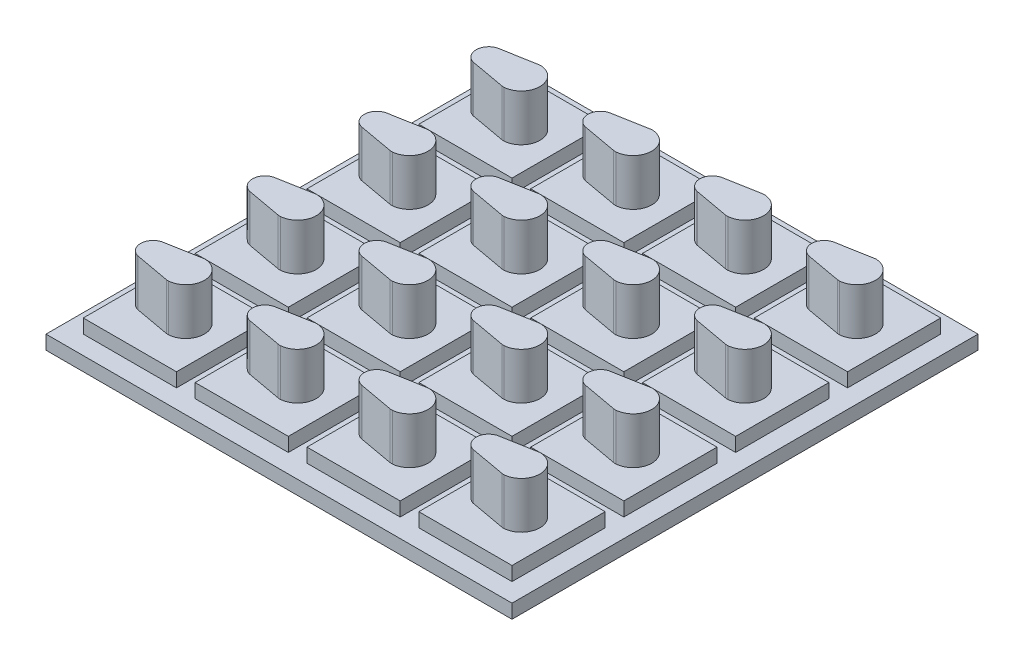
from build123d import *

# Parameters (mm, degrees)
SKETCH1_W              = 10
SKETCH1_H              = 10
BOSS_EXTRUDE5_DEPTH    = 1.5
BOSS_EXTRUDE5_2_DEPTH  = 1.5
BOSS_EXTRUDE5_3_DEPTH  = 1.5
BOSS_EXTRUDE5_4_DEPTH  = 1.5
BOSS_EXTRUDE5_5_DEPTH  = 1.5
BOSS_EXTRUDE5_6_DEPTH  = 1.5
BOSS_EXTRUDE5_7_DEPTH  = 1.5
BOSS_EXTRUDE5_8_DEPTH  = 1.5
BOSS_EXTRUDE5_9_DEPTH  = 1.5
BOSS_EXTRUDE5_10_DEPTH = 1.5
BOSS_EXTRUDE5_11_DEPTH = 1.5
BOSS_EXTRUDE5_12_DEPTH = 1.5
BOSS_EXTRUDE5_13_DEPTH = 1.5
BOSS_EXTRUDE5_14_DEPTH = 1.5
BOSS_EXTRUDE5_15_DEPTH = 1.5
BOSS_EXTRUDE5_16_DEPTH = 1.5
BOSS_EXTRUDE6_DEPTH    = 6.5
SKETCH1_15_W           = 50
SKETCH1_15_H           = 50
BOSS_EXTRUDE7_DEPTH    = 1.5


with BuildPart() as part:
    # Sketch1 → Boss-Extrude5 (new body)
    with BuildSketch(Plane(origin=(0, 0, 0), x_dir=(1, 0, 0), z_dir=(0, 1, 0))):
        with Locations((-37, 24)):
            Rectangle(SKETCH1_W, SKETCH1_H)
    extrude(amount=BOSS_EXTRUDE5_DEPTH)



with BuildPart() as body_2:
    # Sketch1 → Boss-Extrude5 2 (new body)
    with BuildSketch(Plane(origin=(0, 0, 0), x_dir=(1, 0, 0), z_dir=(0, 1, 0))):
        with Locations((-25, 24)):
            Rectangle(SKETCH1_W, SKETCH1_H)
    extrude(amount=BOSS_EXTRUDE5_2_DEPTH)


with BuildPart() as body_3:
    # Sketch1 → Boss-Extrude5 3 (new body)
    with BuildSketch(Plane(origin=(0, 0, 0), x_dir=(1, 0, 0), z_dir=(0, 1, 0))):
        with Locations((-13, 24)):
            Rectangle(SKETCH1_W, SKETCH1_H)
    extrude(amount=BOSS_EXTRUDE5_3_DEPTH)


with BuildPart() as body_4:
    # Sketch1 → Boss-Extrude5 4 (new body)
    with BuildSketch(Plane(origin=(0, 0, 0), x_dir=(1, 0, 0), z_dir=(0, 1, 0))):
        with Locations((-1, 24)):
            Rectangle(SKETCH1_W, SKETCH1_H)
    extrude(amount=BOSS_EXTRUDE5_4_DEPTH)


with BuildPart() as body_5:
    # Sketch1 → Boss-Extrude5 5 (new body)
    with BuildSketch(Plane(origin=(0, 0, 0), x_dir=(1, 0, 0), z_dir=(0, 1, 0))):
        with Locations((-37, 12)):
            Rectangle(SKETCH1_W, SKETCH1_H)
    extrude(amount=BOSS_EXTRUDE5_5_DEPTH)


with BuildPart() as body_6:
    # Sketch1 → Boss-Extrude5 6 (new body)
    with BuildSketch(Plane(origin=(0, 0, 0), x_dir=(1, 0, 0), z_dir=(0, 1, 0))):
        with Locations((-25, 12)):
            Rectangle(SKETCH1_W, SKETCH1_H)
    extrude(amount=BOSS_EXTRUDE5_6_DEPTH)


with BuildPart() as body_7:
    # Sketch1 → Boss-Extrude5 7 (new body)
    with BuildSketch(Plane(origin=(0, 0, 0), x_dir=(1, 0, 0), z_dir=(0, 1, 0))):
        with Locations((-13, 12)):
            Rectangle(SKETCH1_W, SKETCH1_H)
    extrude(amount=BOSS_EXTRUDE5_7_DEPTH)


with BuildPart() as body_8:
    # Sketch1 → Boss-Extrude5 8 (new body)
    with BuildSketch(Plane(origin=(0, 0, 0), x_dir=(1, 0, 0), z_dir=(0, 1, 0))):
        with Locations((-1, 12)):
            Rectangle(SKETCH1_W, SKETCH1_H)
    extrude(amount=BOSS_EXTRUDE5_8_DEPTH)


with BuildPart() as body_9:
    # Sketch1 → Boss-Extrude5 9 (new body)
    with BuildSketch(Plane(origin=(0, 0, 0), x_dir=(1, 0, 0), z_dir=(0, 1, 0))):
        with Locations((-1, 0)):
            Rectangle(SKETCH1_W, SKETCH1_H)
    extrude(amount=BOSS_EXTRUDE5_9_DEPTH)


with BuildPart() as body_10:
    # Sketch1 → Boss-Extrude5 10 (new body)
    with BuildSketch(Plane(origin=(0, 0, 0), x_dir=(1, 0, 0), z_dir=(0, 1, 0))):
        with Locations((-13, 0)):
            Rectangle(SKETCH1_W, SKETCH1_H)
    extrude(amount=BOSS_EXTRUDE5_10_DEPTH)


with BuildPart() as body_11:
    # Sketch1 → Boss-Extrude5 11 (new body)
    with BuildSketch(Plane(origin=(0, 0, 0), x_dir=(1, 0, 0), z_dir=(0, 1, 0))):
        with Locations((-25, 0)):
            Rectangle(SKETCH1_W, SKETCH1_H)
    extrude(amount=BOSS_EXTRUDE5_11_DEPTH)


with BuildPart() as body_12:
    # Sketch1 → Boss-Extrude5 12 (new body)
    with BuildSketch(Plane(origin=(0, 0, 0), x_dir=(1, 0, 0), z_dir=(0, 1, 0))):
        with Locations((-37, 0)):
            Rectangle(SKETCH1_W, SKETCH1_H)
    extrude(amount=BOSS_EXTRUDE5_12_DEPTH)


with BuildPart() as body_13:
    # Sketch1 → Boss-Extrude5 13 (new body)
    with BuildSketch(Plane(origin=(0, 0, 0), x_dir=(1, 0, 0), z_dir=(0, 1, 0))):
        with Locations((-37, -12)):
            Rectangle(SKETCH1_W, SKETCH1_H)
    extrude(amount=BOSS_EXTRUDE5_13_DEPTH)


with BuildPart() as body_14:
    # Sketch1 → Boss-Extrude5 14 (new body)
    with BuildSketch(Plane(origin=(0, 0, 0), x_dir=(1, 0, 0), z_dir=(0, 1, 0))):
        with Locations((-25, -12)):
            Rectangle(SKETCH1_W, SKETCH1_H)
    extrude(amount=BOSS_EXTRUDE5_14_DEPTH)


with BuildPart() as body_15:
    # Sketch1 → Boss-Extrude5 15 (new body)
    with BuildSketch(Plane(origin=(0, 0, 0), x_dir=(1, 0, 0), z_dir=(0, 1, 0))):
        with Locations((-13, -12)):
            Rectangle(SKETCH1_W, SKETCH1_H)
    extrude(amount=BOSS_EXTRUDE5_15_DEPTH)


with BuildPart() as body_16:
    # Sketch1 → Boss-Extrude5 16 (new body)
    with BuildSketch(Plane(origin=(0, 0, 0), x_dir=(1, 0, 0), z_dir=(0, 1, 0))):
        with Locations((-1, -12)):
            Rectangle(SKETCH1_W, SKETCH1_H)
    extrude(amount=BOSS_EXTRUDE5_16_DEPTH)


with BuildPart() as part_1:
    add(part.part)

    add(body_2.part)  # Boss-Extrude6 merges body 2

    add(body_3.part)  # Boss-Extrude6 merges body 3

    add(body_4.part)  # Boss-Extrude6 merges body 4

    add(body_5.part)  # Boss-Extrude6 merges body 5

    add(body_6.part)  # Boss-Extrude6 merges body 6

    add(body_7.part)  # Boss-Extrude6 merges body 7

    add(body_8.part)  # Boss-Extrude6 merges body 8

    add(body_9.part)  # Boss-Extrude6 merges body 9

    add(body_10.part)  # Boss-Extrude6 merges body 10

    add(body_11.part)  # Boss-Extrude6 merges body 11

    add(body_12.part)  # Boss-Extrude6 merges body 12

    add(body_13.part)  # Boss-Extrude6 merges body 13

    add(body_14.part)  # Boss-Extrude6 merges body 14

    add(body_15.part)  # Boss-Extrude6 merges body 15

    add(body_16.part)  # Boss-Extrude6 merges body 16
    # Sketch1<13> → Boss-Extrude6 (add)
    with BuildSketch(Plane(origin=(0, 0, 0), x_dir=(1, 0, 0), z_dir=(0, 1, 0))):
        with BuildLine():
            ThreePointArc((0.14860526, 1.994471478), (0.022146835, 1.995874699), (-0.103477426, 1.981305986))
            Line((-0.103477426, 1.981305986), (-3.791774707, 1.314985976))
            ThreePointArc((-3.791774707, 1.314985976), (-3.866472803, 1.298518324), (-3.939693652, 1.27638924))
            ThreePointArc((-3.939693652, 1.27638924), (-4.85, 0), (-3.939693652, -1.27638924))
            ThreePointArc((-3.939693652, -1.27638924), (-3.866472803, -1.298518324), (-3.791774707, -1.314985976))
            Line((-3.791774707, -1.314985976), (-0.103477426, -1.981305986))
            ThreePointArc((-0.103477426, -1.981305986), (0.022146835, -1.995874699), (0.14860526, -1.994471478))
            ThreePointArc((0.14860526, -1.994471478), (2, 0), (0.14860526, 1.994471478))
        make_face()
        with BuildLine():
            ThreePointArc((-11.85139474, 1.994471478), (-11.977853165, 1.995874699), (-12.103477426, 1.981305986))
            Line((-12.103477426, 1.981305986), (-15.791774707, 1.314985976))
            ThreePointArc((-15.791774707, 1.314985976), (-15.866472803, 1.298518324), (-15.939693652, 1.27638924))
            ThreePointArc((-15.939693652, 1.27638924), (-16.85, 0), (-15.939693652, -1.27638924))
            ThreePointArc((-15.939693652, -1.27638924), (-15.866472803, -1.298518324), (-15.791774707, -1.314985976))
            Line((-15.791774707, -1.314985976), (-12.103477426, -1.981305986))
            ThreePointArc((-12.103477426, -1.981305986), (-11.977853165, -1.995874699), (-11.85139474, -1.994471478))
            ThreePointArc((-11.85139474, -1.994471478), (-10, 0), (-11.85139474, 1.994471478))
        make_face()
        with BuildLine():
            ThreePointArc((-23.85139474, 1.994471478), (-23.977853165, 1.995874699), (-24.103477426, 1.981305986))
            Line((-24.103477426, 1.981305986), (-27.791774707, 1.314985976))
            ThreePointArc((-27.791774707, 1.314985976), (-27.866472803, 1.298518324), (-27.939693652, 1.27638924))
            ThreePointArc((-27.939693652, 1.27638924), (-28.85, 0), (-27.939693652, -1.27638924))
            ThreePointArc((-27.939693652, -1.27638924), (-27.866472803, -1.298518324), (-27.791774707, -1.314985976))
            Line((-27.791774707, -1.314985976), (-24.103477426, -1.981305986))
            ThreePointArc((-24.103477426, -1.981305986), (-23.977853165, -1.995874699), (-23.85139474, -1.994471478))
            ThreePointArc((-23.85139474, -1.994471478), (-22, 0), (-23.85139474, 1.994471478))
        make_face()
        with BuildLine():
            ThreePointArc((0.14860526, 13.994471478), (0.022146835, 13.995874699), (-0.103477426, 13.981305986))
            Line((-0.103477426, 13.981305986), (-3.791774707, 13.314985976))
            ThreePointArc((-3.791774707, 13.314985976), (-3.866472803, 13.298518324), (-3.939693652, 13.27638924))
            ThreePointArc((-3.939693652, 13.27638924), (-4.85, 12), (-3.939693652, 10.72361076))
            ThreePointArc((-3.939693652, 10.72361076), (-3.866472803, 10.701481676), (-3.791774707, 10.685014024))
            Line((-3.791774707, 10.685014024), (-0.103477426, 10.018694014))
            ThreePointArc((-0.103477426, 10.018694014), (0.022146835, 10.004125301), (0.14860526, 10.005528522))
            ThreePointArc((0.14860526, 10.005528522), (2, 12), (0.14860526, 13.994471478))
        make_face()
        with BuildLine():
            ThreePointArc((-11.85139474, 13.994471478), (-11.977853165, 13.995874699), (-12.103477426, 13.981305986))
            Line((-12.103477426, 13.981305986), (-15.791774707, 13.314985976))
            ThreePointArc((-15.791774707, 13.314985976), (-15.866472803, 13.298518324), (-15.939693652, 13.27638924))
            ThreePointArc((-15.939693652, 13.27638924), (-16.85, 12), (-15.939693652, 10.72361076))
            ThreePointArc((-15.939693652, 10.72361076), (-15.866472803, 10.701481676), (-15.791774707, 10.685014024))
            Line((-15.791774707, 10.685014024), (-12.103477426, 10.018694014))
            ThreePointArc((-12.103477426, 10.018694014), (-11.977853165, 10.004125301), (-11.85139474, 10.005528522))
            ThreePointArc((-11.85139474, 10.005528522), (-10, 12), (-11.85139474, 13.994471478))
        make_face()
        with BuildLine():
            ThreePointArc((-23.85139474, 13.994471478), (-23.977853165, 13.995874699), (-24.103477426, 13.981305986))
            Line((-24.103477426, 13.981305986), (-27.791774707, 13.314985976))
            ThreePointArc((-27.791774707, 13.314985976), (-27.866472803, 13.298518324), (-27.939693652, 13.27638924))
            ThreePointArc((-27.939693652, 13.27638924), (-28.85, 12), (-27.939693652, 10.72361076))
            ThreePointArc((-27.939693652, 10.72361076), (-27.866472803, 10.701481676), (-27.791774707, 10.685014024))
            Line((-27.791774707, 10.685014024), (-24.103477426, 10.018694014))
            ThreePointArc((-24.103477426, 10.018694014), (-23.977853165, 10.004125301), (-23.85139474, 10.005528522))
            ThreePointArc((-23.85139474, 10.005528522), (-22, 12), (-23.85139474, 13.994471478))
        make_face()
        with BuildLine():
            ThreePointArc((-11.85139474, -10.005528522), (-11.977853165, -10.004125301), (-12.103477426, -10.018694014))
            Line((-12.103477426, -10.018694014), (-15.791774707, -10.685014024))
            ThreePointArc((-15.791774707, -10.685014024), (-15.866472803, -10.701481676), (-15.939693652, -10.72361076))
            ThreePointArc((-15.939693652, -10.72361076), (-16.85, -12), (-15.939693652, -13.27638924))
            ThreePointArc((-15.939693652, -13.27638924), (-15.866472803, -13.298518324), (-15.791774707, -13.314985976))
            Line((-15.791774707, -13.314985976), (-12.103477426, -13.981305986))
            ThreePointArc((-12.103477426, -13.981305986), (-11.977853165, -13.995874699), (-11.85139474, -13.994471478))
            ThreePointArc((-11.85139474, -13.994471478), (-10, -12), (-11.85139474, -10.005528522))
        make_face()
        with BuildLine():
            ThreePointArc((0.14860526, -10.005528522), (0.022146835, -10.004125301), (-0.103477426, -10.018694014))
            Line((-0.103477426, -10.018694014), (-3.791774707, -10.685014024))
            ThreePointArc((-3.791774707, -10.685014024), (-3.866472803, -10.701481676), (-3.939693652, -10.72361076))
            ThreePointArc((-3.939693652, -10.72361076), (-4.85, -12), (-3.939693652, -13.27638924))
            ThreePointArc((-3.939693652, -13.27638924), (-3.866472803, -13.298518324), (-3.791774707, -13.314985976))
            Line((-3.791774707, -13.314985976), (-0.103477426, -13.981305986))
            ThreePointArc((-0.103477426, -13.981305986), (0.022146835, -13.995874699), (0.14860526, -13.994471478))
            ThreePointArc((0.14860526, -13.994471478), (2, -12), (0.14860526, -10.005528522))
        make_face()
        with BuildLine():
            ThreePointArc((-23.85139474, -10.005528522), (-23.977853165, -10.004125301), (-24.103477426, -10.018694014))
            Line((-24.103477426, -10.018694014), (-27.791774707, -10.685014024))
            ThreePointArc((-27.791774707, -10.685014024), (-27.866472803, -10.701481676), (-27.939693652, -10.72361076))
            ThreePointArc((-27.939693652, -10.72361076), (-28.85, -12), (-27.939693652, -13.27638924))
            ThreePointArc((-27.939693652, -13.27638924), (-27.866472803, -13.298518324), (-27.791774707, -13.314985976))
            Line((-27.791774707, -13.314985976), (-24.103477426, -13.981305986))
            ThreePointArc((-24.103477426, -13.981305986), (-23.977853165, -13.995874699), (-23.85139474, -13.994471478))
            ThreePointArc((-23.85139474, -13.994471478), (-22, -12), (-23.85139474, -10.005528522))
        make_face()
        with BuildLine():
            ThreePointArc((0.14860526, 25.994471478), (0.022146835, 25.995874699), (-0.103477426, 25.981305986))
            Line((-0.103477426, 25.981305986), (-3.791774707, 25.314985976))
            ThreePointArc((-3.791774707, 25.314985976), (-3.866472803, 25.298518324), (-3.939693652, 25.27638924))
            ThreePointArc((-3.939693652, 25.27638924), (-4.85, 24), (-3.939693652, 22.72361076))
            ThreePointArc((-3.939693652, 22.72361076), (-3.866472803, 22.701481676), (-3.791774707, 22.685014024))
            Line((-3.791774707, 22.685014024), (-0.103477426, 22.018694014))
            ThreePointArc((-0.103477426, 22.018694014), (0.022146835, 22.004125301), (0.14860526, 22.005528522))
            ThreePointArc((0.14860526, 22.005528522), (2, 24), (0.14860526, 25.994471478))
        make_face()
        with BuildLine():
            ThreePointArc((-11.85139474, 25.994471478), (-11.977853165, 25.995874699), (-12.103477426, 25.981305986))
            Line((-12.103477426, 25.981305986), (-15.791774707, 25.314985976))
            ThreePointArc((-15.791774707, 25.314985976), (-15.866472803, 25.298518324), (-15.939693652, 25.27638924))
            ThreePointArc((-15.939693652, 25.27638924), (-16.85, 24), (-15.939693652, 22.72361076))
            ThreePointArc((-15.939693652, 22.72361076), (-15.866472803, 22.701481676), (-15.791774707, 22.685014024))
            Line((-15.791774707, 22.685014024), (-12.103477426, 22.018694014))
            ThreePointArc((-12.103477426, 22.018694014), (-11.977853165, 22.004125301), (-11.85139474, 22.005528522))
            ThreePointArc((-11.85139474, 22.005528522), (-10, 24), (-11.85139474, 25.994471478))
        make_face()
        with BuildLine():
            ThreePointArc((-23.85139474, 25.994471478), (-23.977853165, 25.995874699), (-24.103477426, 25.981305986))
            Line((-24.103477426, 25.981305986), (-27.791774707, 25.314985976))
            ThreePointArc((-27.791774707, 25.314985976), (-27.866472803, 25.298518324), (-27.939693652, 25.27638924))
            ThreePointArc((-27.939693652, 25.27638924), (-28.85, 24), (-27.939693652, 22.72361076))
            ThreePointArc((-27.939693652, 22.72361076), (-27.866472803, 22.701481676), (-27.791774707, 22.685014024))
            Line((-27.791774707, 22.685014024), (-24.103477426, 22.018694014))
            ThreePointArc((-24.103477426, 22.018694014), (-23.977853165, 22.004125301), (-23.85139474, 22.005528522))
            ThreePointArc((-23.85139474, 22.005528522), (-22, 24), (-23.85139474, 25.994471478))
        make_face()
        with BuildLine():
            ThreePointArc((-35.85139474, -10.005528522), (-35.977853165, -10.004125301), (-36.103477426, -10.018694014))
            Line((-36.103477426, -10.018694014), (-39.791774707, -10.685014024))
            ThreePointArc((-39.791774707, -10.685014024), (-39.866472803, -10.701481676), (-39.939693652, -10.72361076))
            ThreePointArc((-39.939693652, -10.72361076), (-40.85, -12), (-39.939693652, -13.27638924))
            ThreePointArc((-39.939693652, -13.27638924), (-39.866472803, -13.298518324), (-39.791774707, -13.314985976))
            Line((-39.791774707, -13.314985976), (-36.103477426, -13.981305986))
            ThreePointArc((-36.103477426, -13.981305986), (-35.977853165, -13.995874699), (-35.85139474, -13.994471478))
            ThreePointArc((-35.85139474, -13.994471478), (-34, -12), (-35.85139474, -10.005528522))
        make_face()
        with BuildLine():
            ThreePointArc((-35.85139474, 25.994471478), (-35.977853165, 25.995874699), (-36.103477426, 25.981305986))
            Line((-36.103477426, 25.981305986), (-39.791774707, 25.314985976))
            ThreePointArc((-39.791774707, 25.314985976), (-39.866472803, 25.298518324), (-39.939693652, 25.27638924))
            ThreePointArc((-39.939693652, 25.27638924), (-40.85, 24), (-39.939693652, 22.72361076))
            ThreePointArc((-39.939693652, 22.72361076), (-39.866472803, 22.701481676), (-39.791774707, 22.685014024))
            Line((-39.791774707, 22.685014024), (-36.103477426, 22.018694014))
            ThreePointArc((-36.103477426, 22.018694014), (-35.977853165, 22.004125301), (-35.85139474, 22.005528522))
            ThreePointArc((-35.85139474, 22.005528522), (-34, 24), (-35.85139474, 25.994471478))
        make_face()
        with BuildLine():
            ThreePointArc((-35.85139474, 1.994471478), (-35.977853165, 1.995874699), (-36.103477426, 1.981305986))
            Line((-36.103477426, 1.981305986), (-39.791774707, 1.314985976))
            ThreePointArc((-39.791774707, 1.314985976), (-39.866472803, 1.298518324), (-39.939693652, 1.27638924))
            ThreePointArc((-39.939693652, 1.27638924), (-40.85, 0), (-39.939693652, -1.27638924))
            ThreePointArc((-39.939693652, -1.27638924), (-39.866472803, -1.298518324), (-39.791774707, -1.314985976))
            Line((-39.791774707, -1.314985976), (-36.103477426, -1.981305986))
            ThreePointArc((-36.103477426, -1.981305986), (-35.977853165, -1.995874699), (-35.85139474, -1.994471478))
            ThreePointArc((-35.85139474, -1.994471478), (-34, 0), (-35.85139474, 1.994471478))
        make_face()
        with BuildLine():
            ThreePointArc((-35.85139474, 13.994471478), (-35.977853165, 13.995874699), (-36.103477426, 13.981305986))
            Line((-36.103477426, 13.981305986), (-39.791774707, 13.314985976))
            ThreePointArc((-39.791774707, 13.314985976), (-39.866472803, 13.298518324), (-39.939693652, 13.27638924))
            ThreePointArc((-39.939693652, 13.27638924), (-40.85, 12), (-39.939693652, 10.72361076))
            ThreePointArc((-39.939693652, 10.72361076), (-39.866472803, 10.701481676), (-39.791774707, 10.685014024))
            Line((-39.791774707, 10.685014024), (-36.103477426, 10.018694014))
            ThreePointArc((-36.103477426, 10.018694014), (-35.977853165, 10.004125301), (-35.85139474, 10.005528522))
            ThreePointArc((-35.85139474, 10.005528522), (-34, 12), (-35.85139474, 13.994471478))
        make_face()
    extrude(amount=BOSS_EXTRUDE6_DEPTH)

    # Sketch1<15> → Boss-Extrude7 (add)
    with BuildSketch(Plane(origin=(0, 0, 0), x_dir=(1, 0, 0), z_dir=(0, 1, 0))):
        with Locations((-19, 6)):
            Rectangle(SKETCH1_15_W, SKETCH1_15_H)
    extrude(amount=-BOSS_EXTRUDE7_DEPTH)


solid = part_1.part
